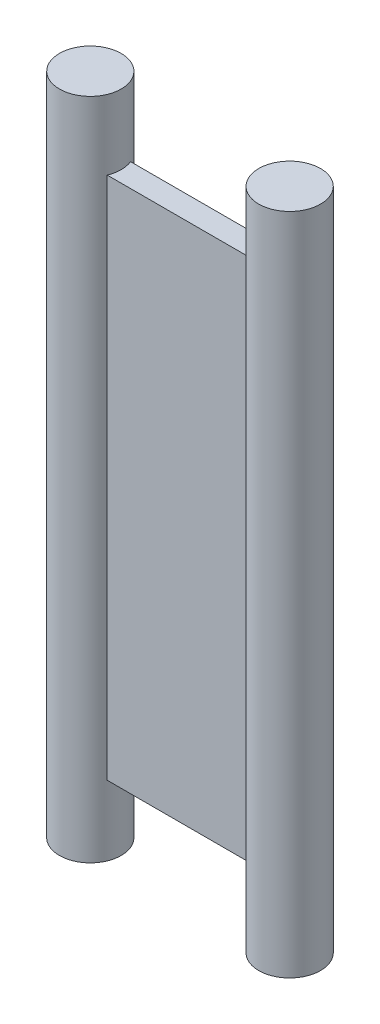
from build123d import *

# Parameters (mm, degrees)
SKETCH1_W           = 8.558
SKETCH1_H           = 1
BOSS_EXTRUDE1_DEPTH = 22.5
SKETCH2_R           = 1.325
BOSS_EXTRUDE2_DEPTH = 14.25


with BuildPart() as part:
    # Sketch1 → Boss-Extrude1 (new body)
    with BuildSketch(Plane(origin=(0, 0, 0), x_dir=(1, 0, 0), z_dir=(0, 1, 0))):
        Rectangle(SKETCH1_W, SKETCH1_H)
    extrude(amount=BOSS_EXTRUDE1_DEPTH)

    # Sketch2 → Boss-Extrude2 (add, symmetric)
    with BuildSketch(Plane(origin=(0, 11.25, 0), x_dir=(1, 0, 0), z_dir=(0, 1, 0))):
        with Locations(Location((-4.279, 0, 0), (0, 0, 270))):
            Circle(SKETCH2_R)
        with Locations(Location((4.279, 0, 0), (0, 0, 270))):
            Circle(SKETCH2_R)
    extrude(amount=BOSS_EXTRUDE2_DEPTH, both=True)


solid = part.part
